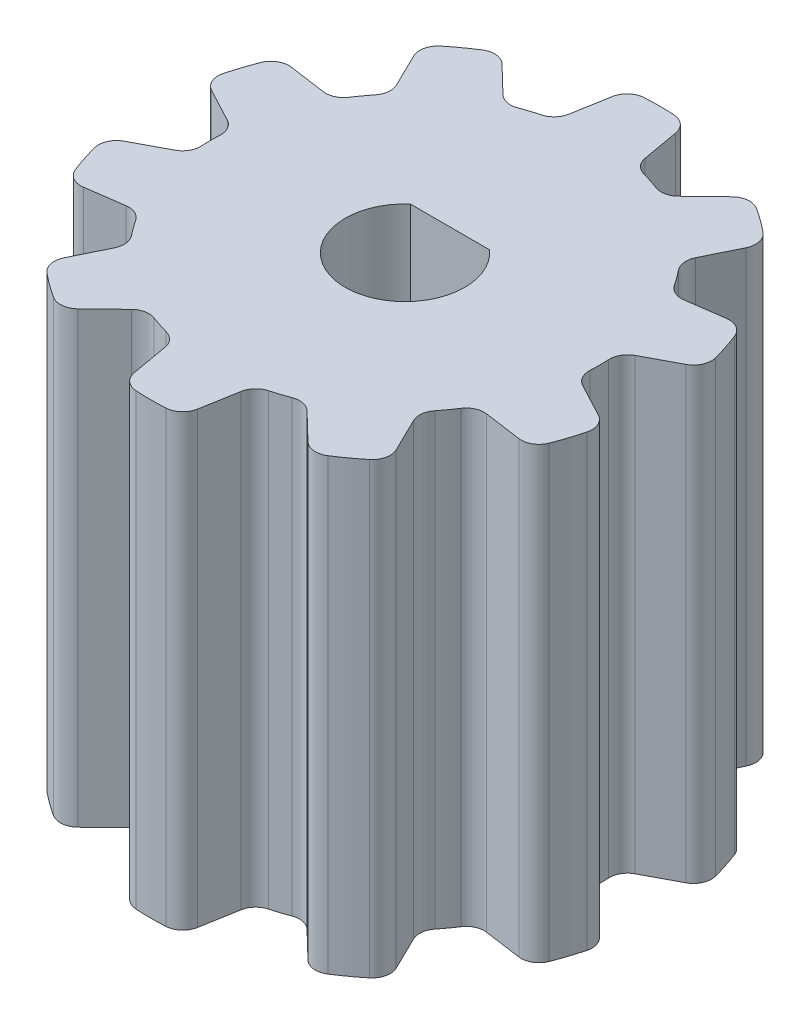
from build123d import *

# Parameters (mm, degrees)
SKETCH1_R                = 6.5
SKETCH1_R_2              = 2
BOSS_EXTRUDE1_DEPTH      = 15
BOSS_EXTRUDE2_START      = -15
BOSS_EXTRUDE2_DEPTH      = 15
FILLET1_R                = 0.6
CIRPATTERN1_COUNT        = 10
FILLET1_OF_CIRPATTERN1_R = 0.6
BOSS_EXTRUDE3_START      = -15
BOSS_EXTRUDE3_DEPTH      = 15
BOSS_EXTRUDE4_DEPTH      = 7


with BuildPart() as part:
    # Sketch1 → Boss-Extrude1 (new body)
    with BuildSketch(Plane(origin=(0, 0, 0), x_dir=(1, 0, 0), z_dir=(0, 1, 0))):
        with Locations(Location((0, 0, 0), (0, 0, 270))):
            Circle(SKETCH1_R)
        with Locations(Location((0, 0, 0), (0, 0, 270))):
            Circle(SKETCH1_R_2, mode=Mode.SUBTRACT)
    extrude(amount=BOSS_EXTRUDE1_DEPTH)

    # Sketch2 → Boss-Extrude2 (add)
    with BuildSketch(Plane(origin=(0, 15, 0), x_dir=(1, 0, 0), z_dir=(0, 1, 0)).offset(BOSS_EXTRUDE2_START)):
        with BuildLine():
            Line((0.975354337, 8.443854802), (1.342832983, 6.359779837))
            ThreePointArc((1.342832983, 6.359779837), (0, 6.5), (-1.342832983, 6.359779837))
            Line((-1.342832983, 6.359779837), (-0.975354337, 8.443854802))
            ThreePointArc((-0.975354337, 8.443854802), (0, 8.5), (0.975354337, 8.443854802))
        make_face()
    boss_extrude2 = extrude(amount=BOSS_EXTRUDE2_DEPTH)

    # Fillet1
    fillet1_edges = [part.edges().sort_by_distance(p)[0] for p in [
        (-0.975354337, 7.5, -8.443854802),
        (0.975354337, 7.5, -8.443854802),
        (1.342832983, 7.5, -6.359779837),
        (-1.342832983, 7.5, -6.359779837),
    ]]
    fillet(fillet1_edges, radius=FILLET1_R)

    # CirPattern1: Boss-Extrude2 ×10 about axis
    cirpattern1_axis = Axis((0, 0, 0), (0, 1, 0))
    for i in range(1, CIRPATTERN1_COUNT):
        add(boss_extrude2.rotate(cirpattern1_axis, i * 360 / CIRPATTERN1_COUNT))

    # Fillet1 of CirPattern1
    fillet1_of_cirpattern1_edges = [part.edges().sort_by_distance(p)[0] for p in [
        (-5.752251559, 7.5, -6.257923138),
        (-4.174095091, 7.5, -7.404520928),
        (-2.651810092, 7.5, -5.934467393),
        (-4.8245595, 7.5, -4.355872545),
        (-8.331984198, 7.5, -1.681677534),
        (-7.729182066, 7.5, -3.53691173),
        (-5.633551844, 7.5, -3.242390109),
        (-6.463468269, 7.5, -0.688169991),
        (-7.729182066, 7.5, 3.53691173),
        (-8.331984198, 7.5, 1.681677534),
        (-6.463468269, 7.5, 0.688169991),
        (-5.633551844, 7.5, 3.242390109),
        (-4.174095091, 7.5, 7.404520928),
        (-5.752251559, 7.5, 6.257923138),
        (-4.8245595, 7.5, 4.355872545),
        (-2.651810092, 7.5, 5.934467393),
        (0.975354337, 7.5, 8.443854802),
        (-0.975354337, 7.5, 8.443854802),
        (-1.342832983, 7.5, 6.359779837),
        (1.342832983, 7.5, 6.359779837),
        (5.752251559, 7.5, 6.257923138),
        (4.174095091, 7.5, 7.404520928),
        (2.651810092, 7.5, 5.934467393),
        (4.8245595, 7.5, 4.355872545),
        (8.331984198, 7.5, 1.681677534),
        (7.729182066, 7.5, 3.53691173),
        (5.633551844, 7.5, 3.242390109),
        (6.463468269, 7.5, 0.688169991),
        (7.729182066, 7.5, -3.53691173),
        (8.331984198, 7.5, -1.681677534),
        (6.463468269, 7.5, -0.688169991),
        (5.633551844, 7.5, -3.242390109),
        (4.174095091, 7.5, -7.404520928),
        (5.752251559, 7.5, -6.257923138),
        (4.8245595, 7.5, -4.355872545),
        (2.651810092, 7.5, -5.934467393),
    ]]
    fillet(fillet1_of_cirpattern1_edges, radius=FILLET1_OF_CIRPATTERN1_R)

    # Sketch3 → Boss-Extrude3 (add)
    with BuildSketch(Plane(origin=(0, 15, 0), x_dir=(1, 0, 0), z_dir=(0, 1, 0)).offset(BOSS_EXTRUDE3_START)):
        with BuildLine():
            Line((-1.322875656, 1.5), (1.322875656, 1.5))
            ThreePointArc((1.322875656, 1.5), (0, 2), (-1.322875656, 1.5))
        make_face()
    extrude(amount=BOSS_EXTRUDE3_DEPTH)

    # Sketch4 → Boss-Extrude4 (add)
    with BuildSketch(Plane.XZ):
        with BuildLine():
            Line((1.322875656, -1.5), (-1.322875656, -1.5))
            ThreePointArc((-1.322875656, -1.5), (0, 2), (1.322875656, -1.5))
        make_face()
    extrude(amount=-BOSS_EXTRUDE4_DEPTH)


solid = part.part
